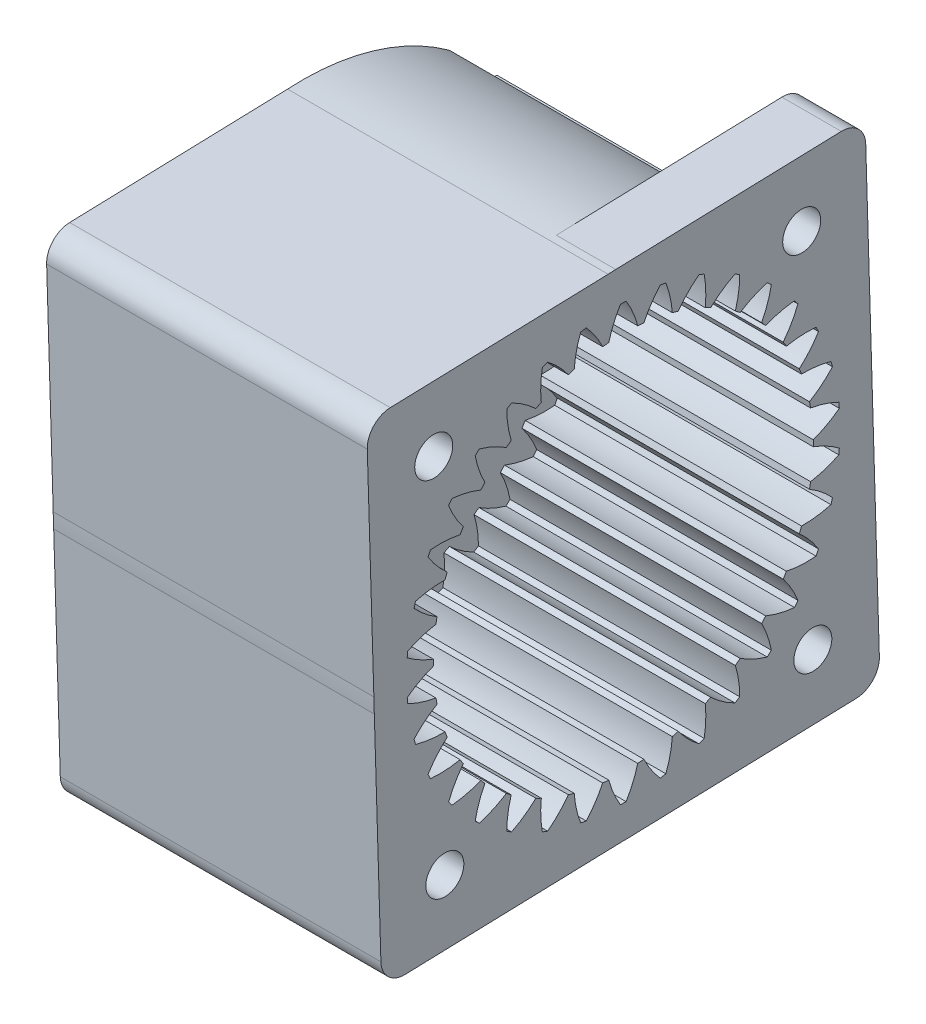
from build123d import *

# Parameters (mm, degrees)
BASPROSKE_W         = 30
BASPROSKE_H         = 5
TOOTHCUT_DEPTH      = 43.213741838
TEETHCUTS_COUNT     = 34
TEETHCUTS_ANGLE     = 349.411764706
BOSS_EXTRUDE1_DEPTH = 30
SKETCH5_R           = 19.394428662
SKETCH5_R_2         = 9
BOSS_EXTRUDE2_DEPTH = 5
CUT_EXTRUDE3_DEPTH  = 3
BOSS_EXTRUDE3_DEPTH = 5
SKETCH3_R           = 1.6
CUT_EXTRUDE1_DEPTH  = 41.795328859
CUT_EXTRUDE4_DEPTH  = 22
FILLET1_R           = 2


with BuildPart() as part:
    # BasProSke → Base-Revolve (revolve)
    with BuildSketch(Plane(origin=(0, 0, 0), x_dir=(1, 0, 0), z_dir=(0, 1, 0)), mode=Mode.PRIVATE) as base_revolve_sk:
        with Locations((15, 18.5)):
            Rectangle(BASPROSKE_W, BASPROSKE_H)
    revolve(base_revolve_sk.sketch.rotate(Axis((-10, 0, 0), (1, 0, 0)), 180), axis=Axis((-10, 0, 0), (1, 0, 0)))

    # TooCutSke → ToothCut (cut, through all)
    with BuildSketch(Plane(origin=(0, 0, 0), x_dir=(0, 0, -1), z_dir=(1, 0, 0))):
        with BuildLine():
            ThreePointArc((1.227128014, 15.927397841), (0.81854303, 17.12541147), (0.236582134, 18.249466565))
            ThreePointArc((0.236582134, 18.249466565), (0, 18.251), (-0.236582134, 18.249466565))
            ThreePointArc((-0.236582134, 18.249466565), (-0.81854303, 17.12541147), (-1.227128014, 15.927397841))
            ThreePointArc((-1.227128014, 15.927397841), (0, 15.9746), (1.227128014, 15.927397841))
        make_face()
    toothcut = extrude(amount=TOOTHCUT_DEPTH, mode=Mode.SUBTRACT)

    # TeethCuts: ToothCut ×34 about axis
    teethcuts_axis = Axis((-10, 0, 0), (1, 0, 0))
    for i in range(1, TEETHCUTS_COUNT):
        add(toothcut.rotate(teethcuts_axis, i * TEETHCUTS_ANGLE / (TEETHCUTS_COUNT - 1)), mode=Mode.SUBTRACT)

    # Sketch1 → Boss-Extrude1 (add)
    with BuildSketch(Plane(origin=(30, 0, 0), x_dir=(0, 0, -1), z_dir=(1, 0, 0))):
        with BuildLine():
            Line((-21.614873711, 20.346805695), (-21, 0))
            ThreePointArc((-21, 0), (-15.291001085, 14.393932257), (-1.268068016, 20.961679406))
            Line((-1.268068016, 20.961679406), (-21.614873711, 20.346805695))
        make_face()
        with BuildLine():
            ThreePointArc((0, -21), (-14.393932257, -15.291001085), (-20.961679406, -1.268068016))
            Line((-20.961679406, -1.268068016), (-20.346805661, -21.614874808))
            Line((-20.346805661, -21.614874808), (0, -21))
        make_face()
    extrude(amount=-BOSS_EXTRUDE1_DEPTH)

    # Sketch5 → Boss-Extrude2 (add)
    with BuildSketch(Plane.ZY):
        Circle(SKETCH5_R)
        Circle(SKETCH5_R_2, mode=Mode.SUBTRACT)
    extrude(amount=-BOSS_EXTRUDE2_DEPTH)

    # Sketch6 → Cut-Extrude3 (cut)
    with BuildSketch(Plane(origin=(30, 0, 0), x_dir=(0, 0, -1), z_dir=(1, 0, 0))):
        with BuildLine():
            Line((-1.268068016, 20.961679406), (-21.614873711, 20.346805695))
            Line((-21.614873711, 20.346805695), (-21, 0))
            ThreePointArc((-21, 0), (-20.990417665, -0.634323451), (-20.961679406, -1.268068016))
            Line((-20.961679406, -1.268068016), (-20.346805661, -21.614874808))
            Line((-20.346805661, -21.614874808), (0, -21))
            ThreePointArc((0, -21), (20.990417665, 0.634323451), (-1.268068016, 20.961679406))
        make_face()
    extrude(amount=-CUT_EXTRUDE3_DEPTH, mode=Mode.SUBTRACT)

    # Sketch7 → Boss-Extrude3 (add)
    with BuildSketch(Plane(origin=(27, 0, 0), x_dir=(0, 0, -1), z_dir=(1, 0, 0))):
        with BuildLine():
            ThreePointArc((-0.634323451, 20.990417665), (14.393932322, 15.291001024), (20.990417671, 0.634323274))
            Line((20.990417671, 0.634323274), (20.356094214, 21.624741116))
            Line((20.356094214, 21.624741116), (-0.634323451, 20.990417665))
        make_face()
        with BuildLine():
            Line((0.634323451, -20.990417665), (21.624741116, -20.356094214))
            Line((21.624741116, -20.356094214), (20.990417671, 0.634323274))
            ThreePointArc((20.990417671, 0.634323274), (15.291001024, -14.393932322), (0.634323451, -20.990417665))
        make_face()
    extrude(amount=-BOSS_EXTRUDE3_DEPTH)

    # Sketch3 → Cut-Extrude1 (cut, through all)
    with BuildSketch(Plane.ZY):
        with Locations((15.961118443, 15.024736206)):
            Circle(SKETCH3_R)
        with Locations((15.024736206, -15.961118443)):
            Circle(SKETCH3_R)
        with Locations((-15.961118443, -15.024736206)):
            Circle(SKETCH3_R)
        with Locations((-15.024736206, 15.961118443)):
            Circle(SKETCH3_R)
    extrude(amount=-CUT_EXTRUDE1_DEPTH, mode=Mode.SUBTRACT)

    # Sketch9 → Cut-Extrude4 (cut)
    with BuildSketch(Plane.ZY):
        Polygon((-11.791574698, 15.961118443), (-13.408155452, 18.761118443), (-16.641316959, 18.761118443), (-18.257897713, 15.961118443), (-16.641316959, 13.161118443), (-13.408155452, 13.161118443), align=None)
        Polygon((-12.727956935, -15.024736206), (-14.344537689, -12.224736206), (-17.577699197, -12.224736206), (-19.19427995, -15.024736206), (-17.577699197, -17.824736206), (-14.344537689, -17.824736206), align=None)
    extrude(amount=-CUT_EXTRUDE4_DEPTH, mode=Mode.SUBTRACT)

    # Fillet1
    fillet1_edges = [part.edges().sort_by_distance(p)[0] for p in [
        (24.5, 21.624741116, -20.356094214),
        (24.5, -20.356094214, -21.624741116),
        (13.5, 20.346805695, 21.614873711),
        (13.5, -21.614874808, 20.346805661),
    ]]
    fillet(fillet1_edges, radius=FILLET1_R)


solid = part.part
